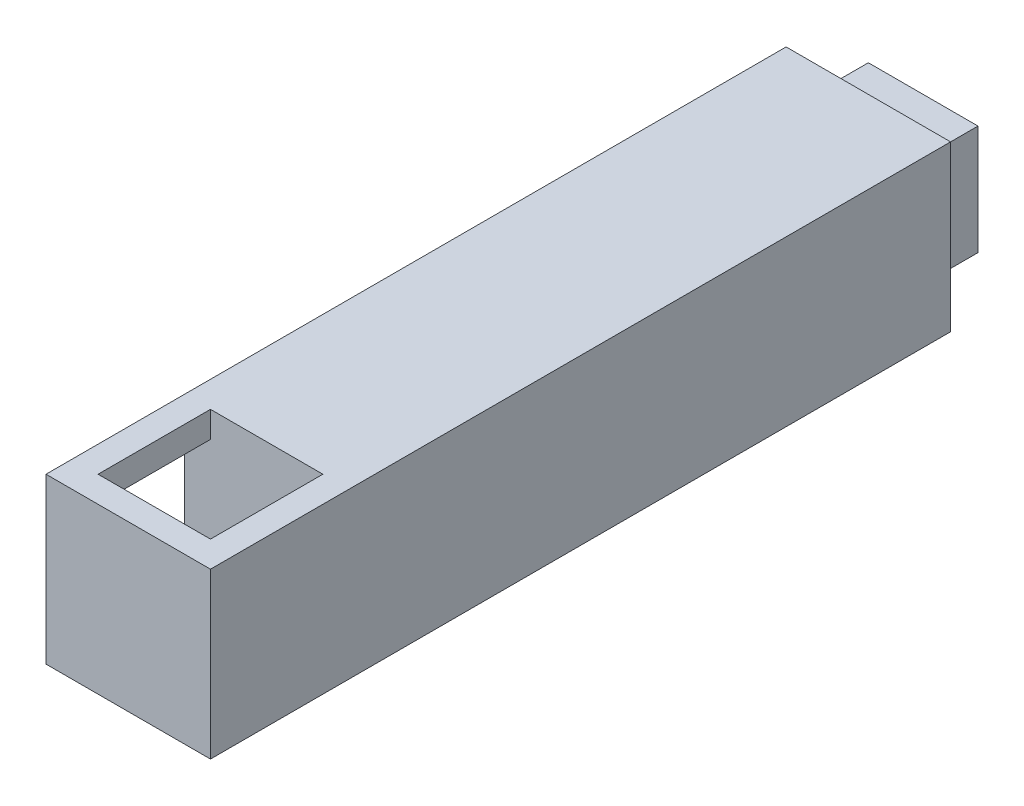
from build123d import *

# Parameters (mm, degrees)
SKETCH1_W           = 30
SKETCH1_H           = 30
BOSS_EXTRUDE1_DEPTH = 135
SKETCH2_W           = 20
SKETCH2_H           = 20
BOSS_EXTRUDE2_DEPTH = 10
SKETCH3_W           = 20.5
SKETCH3_H           = 20.5
CUT_EXTRUDE2_DEPTH  = 15
SKETCH4_W           = 20.5
SKETCH4_H           = 20.5
CUT_EXTRUDE3_DEPTH  = 15


with BuildPart() as part:
    # Sketch1 → Boss-Extrude1 (new body)
    with BuildSketch(Plane.XY):
        Rectangle(SKETCH1_W, SKETCH1_H)
    extrude(amount=BOSS_EXTRUDE1_DEPTH)

    # Sketch2 → Boss-Extrude2 (add)
    with BuildSketch(Plane.XY):
        Rectangle(SKETCH2_W, SKETCH2_H)
    extrude(amount=-BOSS_EXTRUDE2_DEPTH)

    # Sketch3 → Cut-Extrude2 (cut)
    with BuildSketch(Plane.ZY.offset(15)):
        with Locations((120, 0)):
            Rectangle(SKETCH3_W, SKETCH3_H)
    extrude(amount=-CUT_EXTRUDE2_DEPTH, mode=Mode.SUBTRACT)

    # Sketch4 → Cut-Extrude3 (cut)
    with BuildSketch(Plane(origin=(0, 15, 0), x_dir=(1, 0, 0), z_dir=(0, 1, 0))):
        with Locations((0, -120)):
            Rectangle(SKETCH4_W, SKETCH4_H)
    extrude(amount=-CUT_EXTRUDE3_DEPTH, mode=Mode.SUBTRACT)


solid = part.part
